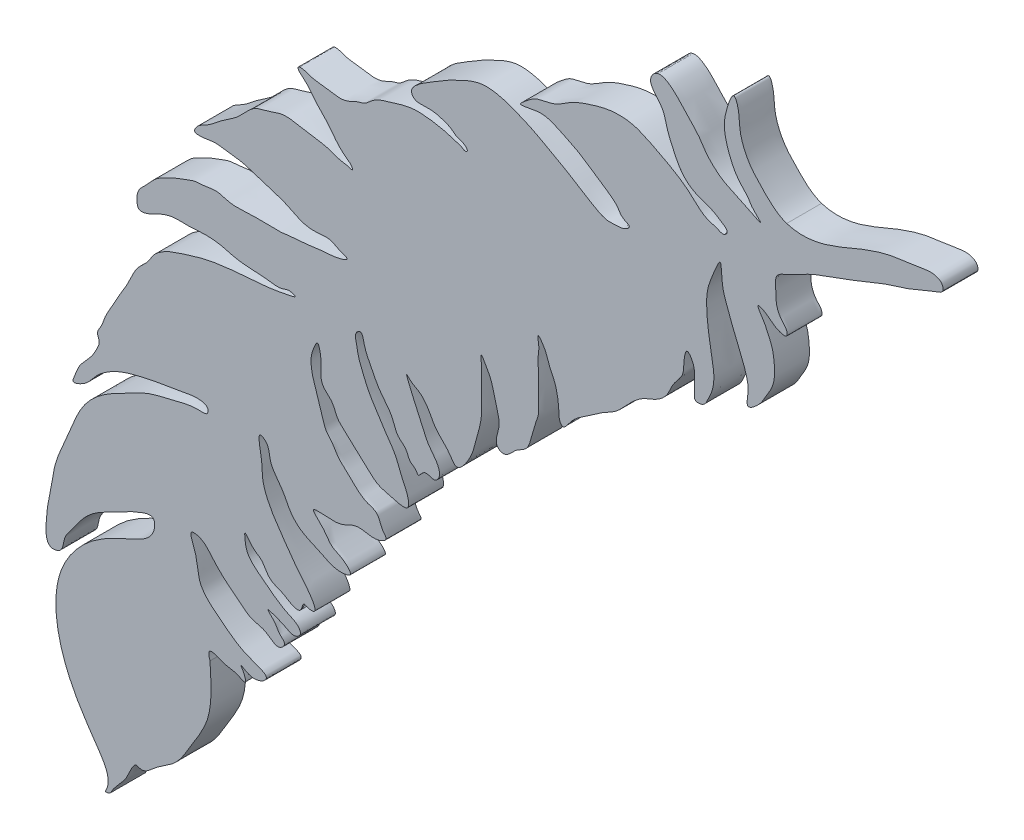
from build123d import *

# Parameters (mm, degrees)
BOSS_EXTRUDE1_DEPTH = 10


with BuildPart() as part:
    # Sketch1 → Boss-Extrude1 (new body)
    with BuildSketch(Plane.XY):
        with BuildLine():
            add(Edge.make_bspline(
                [(-130.946666448, -108.10292482), (-128.84399863, -104.530342678), (-133.22287237, -98.061695476), (-140.438655946, -87.766372354), (-145.743089314, -74.402012855), (-144.857725811, -58.494670019), (-135.455131079, -46.98994318), (-124.863213596, -42.332076144), (-116.665246605, -38.526902193), (-116.710968902, -32.296367955), (-123.101843372, -34.418526524), (-127.850765812, -37.350212928), (-136.151009441, -41.06417848), (-139.712438027, -46.895112385), (-143.055382547, -51.117816867), (-142.794336812, -54.781470879), (-148.115756006, -56.079253951), (-147.897648172, -45.436727814), (-146.783206435, -42.045194689), (-145.814516518, -36.731454769)],
                knots=[0, 0, 0, 0, 0.071998951, 0.142329027, 0.261515503, 0.352988608, 0.452068555, 0.539532667, 0.596775991, 0.612555089, 0.639350133, 0.6927155, 0.747246087, 0.811374733, 0.828147173, 0.855446894, 0.872396777, 0.912939112, 1, 1, 1, 1], degree=3))
            add(Edge.make_bspline(
                [(-145.814516518, -36.731454769), (-145.242455632, -32.421113498), (-141.64273136, -25.702216252), (-138.330972376, -16.066517741), (-132.206199419, -9.835789262), (-125.308060495, -6.413933837), (-118.611759756, -2.671942742), (-110.955128504, -1.24234505), (-106.058132646, 0.350015294), (-101.479144129, -0.101626806), (-101.330714925, 2.28346232), (-104.801510711, 3.090871147), (-109.30117032, 2.095386568), (-115.581597821, 1.156421453), (-121.759792184, -0.161781964), (-127.971466931, -1.95165259), (-133.831678047, -5.737847388), (-135.995173651, -9.749067366), (-140.743428765, -11.527214114), (-139.278763518, -8.229919487), (-138.319891301, -5.523200427), (-135.087110057, -2.591026096), (-133.414510637, 0.339124125), (-132.34223324, 2.813576457), (-133.650988301, 4.796435665), (-131.755722585, 6.993350538), (-131.137809622, 9.848997367), (-128.87980352, 13.276543204), (-127.235628527, 16.789870433), (-124.82773181, 20.424626579), (-123.403387755, 23.552685937), (-121.588832712, 27.095506235), (-118.740132801, 29.102137863), (-117.316638013, 32.014267115), (-114.937161291, 34.030820499), (-112.222627321, 35.387813915), (-108.497354278, 36.60339141), (-104.884014168, 37.786146805), (-98.79455938, 39.246540507), (-92.161271613, 39.796703432), (-85.14091211, 40.271528356), (-80.390512154, 41.01839479), (-78.062692428, 41.52405305), (-75.776531463, 42.026097877), (-78.328063592, 42.973793787), (-80.956548209, 41.452617496), (-85.625974961, 42.646477915), (-90.4373094, 42.556452649), (-94.365177118, 43.175429971), (-97.629352329, 44.235833502), (-100.861784989, 44.577327918), (-104.47443279, 44.57484388), (-107.700732766, 44.163096301), (-111.422949341, 44.481163343), (-115.371610084, 43.386695265), (-118.342812669, 41.358631812), (-121.576919506, 40.944795769), (-122.059301419, 43.863600617), (-121.451661892, 46.359201513), (-119.246124278, 48.231552323), (-117.623555116, 50.267705683), (-115.511445479, 52.092697156), (-113.11502216, 53.125941854), (-110.68155432, 54.429937793), (-107.87135406, 55.339237855), (-105.283150015, 56.473798834), (-102.169264444, 56.413535007), (-99.089764506, 57.348870589), (-95.302098312, 55.792381581), (-91.995588171, 55.828708751), (-88.503073705, 56.087635178), (-85.618440901, 56.041502674), (-82.469641265, 55.932746946), (-79.753716469, 56.00009143), (-76.432156588, 56.595334289), (-72.713663139, 56.634549306), (-67.847067804, 57.555765617), (-64.689477847, 57.373342333), (-60.466293519, 59.020565038), (-64.210725333, 59.898157325), (-66.580278471, 61.732939283), (-70.780633448, 60.720299125), (-75.399052468, 61.67060961), (-79.231795661, 64.042165839), (-83.810347678, 65.321731404), (-87.782259351, 66.607212329), (-91.854180898, 68.025877087), (-95.488279466, 68.162965639), (-99.419833712, 69.025802344), (-101.871024947, 68.332800337), (-105.751619667, 68.174255698), (-104.498934975, 70.807435684), (-101.144676596, 72.007931261), (-97.403058945, 75.623331333), (-92.188706235, 78.47249998), (-88.877631264, 83.366675992), (-84.115673213, 84.067388712), (-79.421485824, 86.15224811), (-73.323539877, 84.432980935), (-67.589918845, 84.030815925), (-63.436104048, 82.179338827), (-61.625928006, 82.188376385), (-59.797270323, 81.472067188), (-60.368872999, 82.886403424), (-61.97815928, 83.859341495), (-64.564579293, 86.229957904), (-67.118411854, 90.04159261), (-70.569017162, 93.137197084), (-72.787912004, 96.465214024), (-74.739402581, 97.943377791), (-75.54849876, 98.818635395), (-75.784223467, 99.826615001), (-73.149138773, 99.611565439), (-71.706867545, 98.705954361), (-68.748076674, 98.503430305), (-66.179283714, 98.098117654), (-63.53815677, 97.655607477), (-60.953370333, 98.092662601), (-58.967173155, 99.418496928), (-56.327639154, 99.881453245), (-53.820970888, 102.686112772), (-48.724318809, 104.133935688), (-43.135666342, 105.866383409), (-38.557211991, 105.524420004), (-34.847570741, 104.970098538), (-32.082049778, 104.227955066), (-29.850358371, 103.494195503), (-28.574928505, 103.072379985), (-27.801748723, 102.414781434), (-26.540027673, 103.055544877), (-28.610138755, 104.695835747), (-30.267141858, 104.845551936), (-31.700481758, 106.26242098), (-34.073434231, 107.187330612), (-36.794916746, 107.996218248), (-39.73826179, 107.871350932), (-42.071254501, 107.772843752), (-43.73681162, 110.064406439), (-40.385507128, 113.324291243), (-36.9310323, 115.06053788), (-32.793764419, 117.750208218), (-28.470751582, 119.796156686), (-22.453251151, 122.395218171), (-14.897381392, 120.582454796), (-8.185320907, 117.600492556), (-1.869548078, 113.976211189), (4.174968739, 110.690406526), (9.058143834, 107.26183992), (12.942883378, 105.513006615), (15.773865937, 105.832529525), (17.707603841, 105.768567092), (20.171603056, 107.545480286), (17.087528749, 108.396709253), (16.13237752, 110.78173046), (12.911667413, 113.226643385), (9.128916361, 115.651862407), (4.797731041, 118.733296089), (0.674656472, 120.662245028), (-3.500111889, 122.564297256), (-6.823994656, 123.159440186), (-13.383888808, 121.29326119), (-9.710098667, 124.175269989), (-7.310471252, 126.182923479), (-1.920757682, 126.484663151), (2.684841618, 130.287135756), (7.892015028, 131.998003926), (13.819017766, 133.756845531), (19.831461535, 133.85183085), (25.745052965, 131.06889639), (31.169634393, 128.279776469), (36.759672285, 124.784505734), (40.71647181, 120.348941721), (44.306323196, 119.737983528), (46.412594304, 118.524901777), (48.042526638, 120.323526993), (45.435866559, 121.936094666), (42.638709278, 123.883258043), (37.975770452, 124.862137224), (34.050747496, 128.363242971), (32.076714085, 132.593101292), (30.074809151, 136.975272581), (29.255957546, 142.079770203), (26.099362379, 144.288749559), (25.54598775, 146.16182556)],
                knots=[0, 0, 0, 0, 0.01806207, 0.032075461, 0.042445579, 0.053931605, 0.064471052, 0.074798709, 0.085752057, 0.088562576, 0.090359229, 0.093440465, 0.100907297, 0.110977094, 0.119788027, 0.127610057, 0.138521721, 0.146809042, 0.149917885, 0.152474568, 0.157498493, 0.164086093, 0.169478055, 0.172248796, 0.174620779, 0.17816222, 0.182688529, 0.187179208, 0.195196344, 0.199130039, 0.205526123, 0.20975237, 0.215716675, 0.21970991, 0.223159395, 0.22866976, 0.232435025, 0.239705069, 0.244718534, 0.258870767, 0.267501439, 0.275031968, 0.277821057, 0.279495163, 0.281568722, 0.284600884, 0.293371013, 0.299580693, 0.305357528, 0.309969758, 0.31405125, 0.319011943, 0.325221623, 0.327703347, 0.334762054, 0.341688298, 0.343534821, 0.346795912, 0.351241175, 0.354536023, 0.358573735, 0.362331731, 0.366140318, 0.369542203, 0.373964522, 0.378645161, 0.381213515, 0.387029856, 0.391622034, 0.397914276, 0.400812734, 0.406434854, 0.410073635, 0.414128241, 0.417881687, 0.424267208, 0.429938356, 0.438041244, 0.440074859, 0.444068312, 0.447026298, 0.454302451, 0.459767351, 0.466979811, 0.472993196, 0.479765244, 0.484683035, 0.49102074, 0.495276862, 0.50076423, 0.504217964, 0.50563077, 0.510840155, 0.519174267, 0.527113099, 0.535889462, 0.542321381, 0.546583121, 0.557287317, 0.567308109, 0.571412981, 0.575466744, 0.5763099, 0.577593411, 0.579406686, 0.585318613, 0.591439036, 0.598986339, 0.604681543, 0.608135277, 0.609259822, 0.6096814, 0.612114445, 0.616010862, 0.618595135, 0.62402049, 0.627261856, 0.629776416, 0.634889782, 0.637138873, 0.640793587, 0.650011004, 0.658916105, 0.665369775, 0.669135039, 0.674769911, 0.677462988, 0.678983009, 0.680579791, 0.681134413, 0.684130287, 0.686694645, 0.689241617, 0.691978754, 0.697513256, 0.700903064, 0.70468192, 0.706402342, 0.711450455, 0.719706695, 0.724641137, 0.731851229, 0.740139282, 0.751504456, 0.763022871, 0.771422751, 0.78220077, 0.791999099, 0.796810091, 0.799622366, 0.803660078, 0.805767968, 0.808795617, 0.812204527, 0.817004139, 0.825099008, 0.831542608, 0.83923346, 0.844607545, 0.850004477, 0.856479295, 0.859521584, 0.864039479, 0.871218691, 0.880285066, 0.888714191, 0.894109223, 0.906513437, 0.912777915, 0.921542197, 0.932251501, 0.940851626, 0.94503485, 0.947904868, 0.949662631, 0.952766095, 0.957402714, 0.965785487, 0.971471081, 0.979059933, 0.985216547, 0.991935901, 1, 1, 1, 1], degree=3))
            add(Edge.make_bspline(
                [(25.54598775, 146.16182556), (25.135110038, 147.603399244), (26.734841175, 149.836153512), (29.495741943, 149.334111861), (31.083703357, 148.320244972), (32.778768536, 146.907131848), (34.445965575, 145.008848919), (36.715434137, 142.475056555), (39.128184415, 140.244589684), (41.416132824, 136.413523007), (44.643927588, 133.012264737), (49.815859201, 130.247602894), (53.117076405, 129.13210017), (58.820083768, 125.938307833), (54.430843884, 129.571769478), (53.428936519, 131.874717104), (50.556921091, 134.395952286), (48.017564148, 139.051639567), (46.2030938, 145.552965783), (47.084884296, 150.051717443), (49.324823859, 156.670885027), (51.097242483, 150.958133196), (50.833922854, 147.356761604), (52.3270201, 142.646756417), (54.48538747, 139.048456505), (58.488583559, 134.903784883), (61.468819884, 131.742360386), (64.530450324, 130.711500919)],
                knots=[0, 0, 0, 0, 0.042354756, 0.054881382, 0.078229675, 0.096503531, 0.118961256, 0.151480831, 0.195631267, 0.213422907, 0.280712856, 0.331134975, 0.373483284, 0.407046612, 0.444715958, 0.46403929, 0.488541767, 0.550400821, 0.620287926, 0.668346568, 0.710883517, 0.740446817, 0.786590415, 0.832747527, 0.876319464, 0.908580461, 1, 1, 1, 1], degree=3))
            add(Edge.make_bspline(
                [(64.530450324, 130.711500919), (68.486873516, 129.433461031), (76.088818046, 130.592281636), (85.80301634, 135.216292695), (94.587242461, 138.044307271), (101.891231339, 138.57037315), (106.816007515, 139.711286176), (109.226261687, 138.024081576), (109.670117736, 135.913795104), (107.402326324, 135.128286522), (104.314837235, 134.019206662), (99.72516474, 131.811995054), (93.611912005, 130.21373535), (87.225300335, 127.611267878), (79.564485529, 124.427170913), (71.322996091, 121.914972619), (65.744356197, 118.340161787), (60.986313351, 116.704894794), (61.489653201, 112.381277431), (61.344364118, 108.832435523), (62.945870147, 105.872539479), (64.585311384, 104.496717606), (64.803883504, 102.223659821), (60.734681721, 103.060091815), (59.710579041, 105.039251367), (55.270355653, 106.943934235), (57.982804649, 103.280519117), (59.130334055, 100.802958321), (60.639869315, 97.379761824), (61.081975106, 93.213021665), (61.099123782, 88.74542929), (58.539239953, 84.831649743), (56.999887156, 81.872788933), (52.660198942, 78.381185705), (53.487750643, 82.824327854), (53.503138515, 85.051039974), (52.646086959, 88.381858965), (51.308427395, 91.959829671), (49.236994483, 96.54589251), (47.379756828, 101.840223688), (45.793359732, 105.752952203), (45.839741323, 113.482930127), (43.173555946, 106.955934262), (41.272018224, 102.556290781), (41.638286698, 94.365343354), (42.913256058, 87.864365591), (43.869539437, 82.017231884), (43.284894717, 78.195276096), (41.764773412, 75.436131097), (40.911790263, 73.435236133), (38.021949793, 73.209585076), (38.091095342, 76.150288162), (38.008006643, 78.963877497), (38.148550041, 82.187051759), (35.528365155, 86.178245166), (34.934541816, 80.993506954), (34.940472062, 77.642544588), (31.743483478, 74.844359272), (30.523916285, 70.860475294), (27.404968612, 68.133310664), (23.054349605, 66.816572203), (19.217509592, 63.520881233), (15.997542545, 59.447507806), (11.323909413, 57.297189876), (6.702679625, 53.721916097), (3.178154602, 51.792381766), (0.472291436, 47.508513065), (-0.744089808, 49.144119534), (-0.789893368, 51.240166505), (-1.058399808, 54.658003451), (-1.903319085, 58.125622573), (-3.985894559, 61.904675195), (-4.312065599, 64.44944876), (-7.276126169, 68.21062039), (-6.377424207, 64.494887321), (-7.04016165, 61.376751253), (-6.359473286, 56.315993227), (-6.907347765, 51.377066279), (-6.46908162, 47.539366611), (-8.057591807, 44.097046529), (-8.603427675, 40.734246106), (-10.075108296, 36.938462942), (-13.168738913, 35.878518843), (-14.777486388, 33.654433257), (-16.869168653, 32.550885733), (-19.76925732, 34.464394512), (-17.208492204, 38.933801097), (-18.923067179, 43.723943951), (-19.829848503, 48.811232852), (-21.30527932, 51.501241289), (-23.36868452, 55.148262332), (-22.784662454, 50.174746331), (-23.345546982, 46.305392975), (-22.527880463, 39.259673398), (-24.751111397, 32.0895961), (-25.726571417, 26.932176756), (-30.239250737, 21.789352524), (-32.759336154, 26.4706821), (-36.282570849, 28.874241074), (-38.182282057, 33.507154129), (-40.833213766, 36.452866395), (-43.091085442, 37.232745876), (-45.315518503, 39.886005697), (-43.183085354, 35.518080991), (-42.268071883, 32.858930464), (-40.222784461, 29.078211383), (-38.605332298, 24.21125603), (-35.207593906, 20.92909597), (-34.907949574, 17.852047015), (-36.510015897, 15.865429401), (-38.778419433, 17.475204348), (-40.183416019, 16.324408973), (-41.193523627, 14.946693576), (-41.892032301, 16.763809802), (-43.85128732, 17.335190352), (-44.392946154, 20.30944802), (-47.52995752, 22.042706841), (-48.486905527, 26.831367711), (-52.345084567, 30.45157676), (-54.713285426, 35.777394508), (-56.560457103, 38.775792479), (-57.249799821, 43.21196217), (-59.718614015, 41.549814504), (-58.859183899, 39.504778859), (-58.456255097, 36.129338894), (-56.954026179, 32.429423314), (-54.930021124, 27.981453919), (-52.418676089, 24.432716264), (-50.385440359, 20.911420544), (-47.436108046, 17.107784721), (-46.066102636, 12.503721705), (-44.131906111, 9.17587217), (-43.564501938, 5.091261433), (-47.122647168, 5.526082384), (-49.664716664, 6.250273932), (-53.15470846, 7.176364057), (-55.847379052, 9.91239778), (-59.124953937, 12.697141139), (-61.765365305, 15.37828747), (-64.674405281, 17.852876291), (-65.429185146, 21.425814425), (-69.442285574, 23.868452542), (-68.988325737, 28.702194826), (-69.096969671, 31.398454953), (-70.023822894, 34.406732558), (-71.913463216, 30.474219619), (-72.105425377, 27.305750715), (-70.82085649, 22.156592705), (-69.363178999, 18.544521736), (-68.422206422, 15.50923315), (-67.850488892, 13.084339893), (-65.577236476, 11.074751108), (-64.304881264, 8.083442692), (-61.156993183, 5.74520795), (-58.71920247, 2.82362992), (-55.799410716, 0.998978312), (-52.981612075, 0.38356102), (-52.029697942, -1.926023184), (-51.430027745, -3.618939394), (-49.80828674, -5.154908562), (-53.914829766, -7.71536169), (-58.055374037, -5.003793167), (-63.391960041, -8.504633291), (-66.917290029, -8.067344455), (-72.761928578, -7.803894774), (-67.843955764, -11.547365424), (-66.419039208, -14.924296271), (-63.022264177, -15.912408956), (-59.382167246, -19.272737149), (-65.204372944, -20.420451523), (-68.848397938, -17.761567267), (-74.207213581, -15.866134359), (-77.880109275, -12.601801019), (-79.973927646, -7.32998578), (-84.044919296, -3.310266697), (-83.850247762, 1.214233074), (-87.737561235, 4.047845609), (-85.675762089, -3.651118933), (-86.204621069, -8.770446776), (-83.053984929, -15.304997829), (-78.97574375, -20.856383953), (-75.534989105, -25.857218364), (-72.627746466, -28.958780157), (-69.708477214, -33.654948252), (-72.569755763, -33.638468077), (-74.399929286, -32.453047798), (-74.516161918, -36.010620017), (-77.881108456, -34.909727141), (-80.121990559, -33.083410777), (-84.109129125, -32.22850714), (-85.833767508, -27.683438305), (-88.590128633, -26.997407322), (-91.004916728, -23.117904517), (-90.818258117, -26.127839976), (-90.324312859, -29.294180188), (-86.002751742, -32.582098155), (-82.292565775, -35.566245427), (-78.642766462, -37.808790745), (-75.883280855, -38.765558312), (-74.442621681, -41.116972295), (-76.738930109, -42.840846342), (-79.521364039, -41.182026385), (-81.45161408, -40.424876197), (-85.286546676, -39.081357046), (-81.81657541, -41.866856516), (-81.44989033, -43.831783855), (-78.793586853, -45.596239896), (-81.625187961, -48.467820843), (-84.7522756, -44.751910335), (-89.266467789, -44.638793579), (-92.444731724, -41.487994433), (-96.378117178, -38.770741074), (-100.075355592, -35.045923887), (-102.726972735, -31.472184065), (-107.326677748, -30.795798619), (-104.035061516, -37.295794994), (-104.833355378, -43.492410631), (-97.545648078, -49.224334249), (-91.818976779, -53.572691644), (-87.616447019, -54.794440198), (-83.163853076, -56.822169532), (-88.491878893, -60.188547286), (-92.928427684, -56.295589382), (-90.949261134, -58.846266263), (-90.340128636, -61.661469832), (-93.62591295, -59.553551577), (-96.95728075, -59.961774936), (-102.34430604, -56.438603777), (-100.888797188, -60.632712192)],
                knots=[0, 0, 0, 0, 0.01357411, 0.024795071, 0.036190854, 0.043876346, 0.049939587, 0.051582656, 0.053318452, 0.055842826, 0.058095608, 0.064889919, 0.072448855, 0.079323032, 0.087898329, 0.100377909, 0.1074325, 0.111021593, 0.115151545, 0.11982641, 0.123329949, 0.125753472, 0.127129867, 0.129251655, 0.13550732, 0.137299261, 0.140865784, 0.143728229, 0.148481289, 0.15249539, 0.15791452, 0.163033656, 0.167106308, 0.171132498, 0.17422448, 0.177304983, 0.179582132, 0.185423162, 0.190171753, 0.196585052, 0.203213935, 0.207969885, 0.211731959, 0.218529081, 0.227529059, 0.237066443, 0.241226326, 0.247301675, 0.249470958, 0.25179546, 0.254452327, 0.255519228, 0.26059543, 0.264210473, 0.267175097, 0.271235396, 0.274654149, 0.279753353, 0.283790255, 0.288499429, 0.292826044, 0.298876138, 0.305072198, 0.309907983, 0.315963803, 0.323799149, 0.326426822, 0.327343733, 0.329569881, 0.333517386, 0.338750494, 0.341506402, 0.347451401, 0.349448012, 0.352201234, 0.354743249, 0.361894605, 0.36793031, 0.371738114, 0.37442184, 0.380351012, 0.383353011, 0.387338826, 0.390290247, 0.392662587, 0.394226996, 0.400408764, 0.405115912, 0.411538594, 0.416331228, 0.418383027, 0.420411186, 0.427100194, 0.435751818, 0.442145745, 0.451780157, 0.455631916, 0.458766187, 0.465672065, 0.470834974, 0.475017919, 0.478185587, 0.479482515, 0.483861716, 0.485490788, 0.490409315, 0.497393804, 0.50279302, 0.505452957, 0.506999677, 0.510128018, 0.511907428, 0.513114836, 0.514167077, 0.516673462, 0.51968403, 0.522932027, 0.527855245, 0.534775762, 0.540406779, 0.546371156, 0.549151191, 0.550395368, 0.554131297, 0.555059664, 0.561958052, 0.567173273, 0.571453861, 0.576461049, 0.580775084, 0.587541221, 0.591744276, 0.594990469, 0.597532483, 0.601157726, 0.604747835, 0.609105881, 0.613756364, 0.619187258, 0.621770415, 0.626295592, 0.630583032, 0.635975936, 0.640158616, 0.641506513, 0.643747622, 0.649199611, 0.654916217, 0.660365057, 0.662439873, 0.66559233, 0.668425196, 0.672287426, 0.676175948, 0.681283788, 0.684938838, 0.687637417, 0.69029388, 0.69251638, 0.694100733, 0.696256814, 0.704294133, 0.70885693, 0.715220814, 0.718112434, 0.722721706, 0.727330977, 0.731326472, 0.735208703, 0.737754767, 0.746037888, 0.751006853, 0.75648922, 0.761830143, 0.769894041, 0.774247132, 0.776108793, 0.782499197, 0.788084506, 0.797340691, 0.804154864, 0.812037128, 0.816303444, 0.821157457, 0.822730479, 0.824361849, 0.826815069, 0.82977206, 0.83281346, 0.837425284, 0.842162097, 0.846490354, 0.849276613, 0.850036817, 0.854763482, 0.860666526, 0.866786229, 0.871115392, 0.87482144, 0.876596057, 0.878853498, 0.881870203, 0.886115576, 0.888046217, 0.890882892, 0.89435242, 0.896693346, 0.898916469, 0.903762862, 0.908880418, 0.913689282, 0.917994026, 0.925031673, 0.931067057, 0.932875715, 0.937589669, 0.94611853, 0.956434271, 0.964840883, 0.969947188, 0.97239388, 0.97780406, 0.981391866, 0.983344282, 0.985763675, 0.987790954, 0.992403475, 1, 1, 1, 1], degree=3))
            add(Edge.make_bspline(
                [(-100.888797188, -60.632712192), (-100.62686373, -65.433275191), (-99.796394551, -74.322964614), (-106.026244645, -83.678140341), (-110.266204064, -91.506220491), (-116.273770804, -94.253557574), (-119.787736054, -98.173977854), (-122.21292044, -96.824452301), (-123.88130012, -99.163135309), (-125.01962931, -103.005459441), (-128.416739231, -105.57205174), (-129.399753104, -107.678494688)],
                knots=[0, 0, 0, 0, 0.255620861, 0.413056562, 0.567957432, 0.683936218, 0.763553911, 0.779621327, 0.806757916, 0.880982983, 1, 1, 1, 1], degree=3))
            add(Edge.make_bspline(
                [(-129.399753104, -107.678494688), (-130.061164456, -108.307315311), (-130.946666448, -108.10292482)],
                knots=[0, 0, 0, 1, 1, 1], degree=2))
        make_face()
    extrude(amount=BOSS_EXTRUDE1_DEPTH)


solid = part.part
